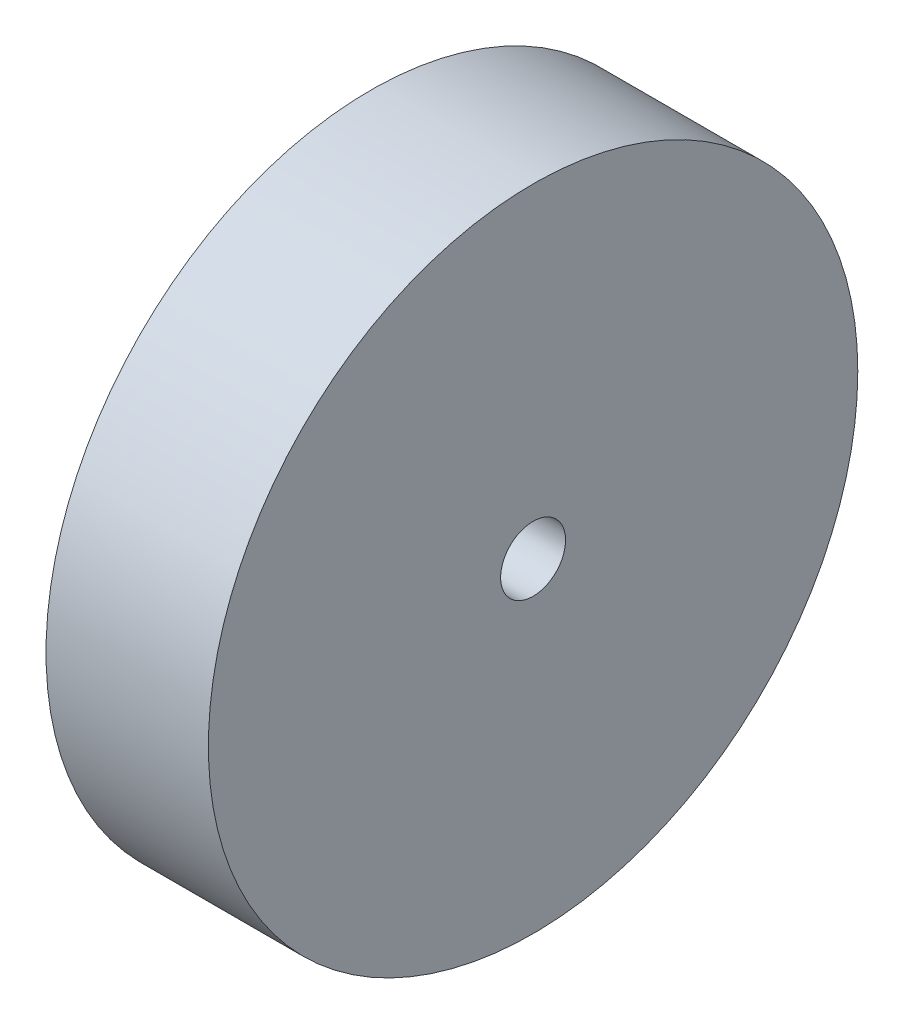
from build123d import *

# Parameters (mm, degrees)
SKETCH_1_R      = 10
SKETCH_1_R_2    = 1
EXTRUDE_1_DEPTH = 5


with BuildPart() as part:
    # 草图1 → 凸台-拉伸1 (new body)
    with BuildSketch(Plane(origin=(0, 0, 0), x_dir=(0, 0, -1), z_dir=(1, 0, 0))):
        Circle(SKETCH_1_R)
        Circle(SKETCH_1_R_2, mode=Mode.SUBTRACT)
    extrude(amount=EXTRUDE_1_DEPTH)


solid = part.part
